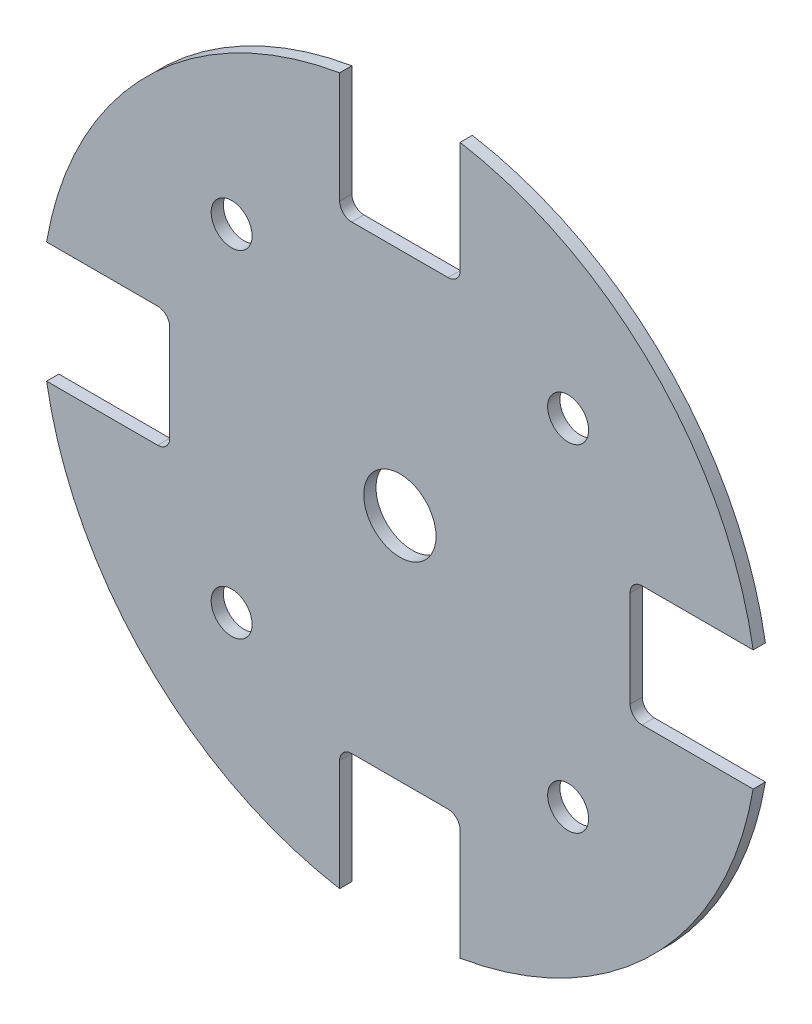
from build123d import *

# Parameters (mm, degrees)
SKETCH1_R           = 1.7
SKETCH1_R_2         = 3
BOSS_EXTRUDE1_DEPTH = 1.016


with BuildPart() as part:
    # Sketch1 → Boss-Extrude1 (new body)
    with BuildSketch(Plane.XY):
        with BuildLine():
            Line((-29.326822194, 5), (-20.106608804, 5))
            ThreePointArc((-20.106608804, 5), (-19.399502023, 4.707106781), (-19.106608804, 4))
            Line((-19.106608804, 4), (-19.106608804, -4))
            ThreePointArc((-19.106608804, -4), (-19.399502023, -4.707106781), (-20.106608804, -5))
            Line((-20.106608804, -5), (-29.326822194, -5))
            ThreePointArc((-29.326822194, -5), (-21.03642674, -21.03642674), (-5, -29.326822194))
            Line((-5, -29.326822194), (-5, -20.106608804))
            ThreePointArc((-5, -20.106608804), (-4.707106781, -19.399502023), (-4, -19.106608804))
            Line((-4, -19.106608804), (4, -19.106608804))
            ThreePointArc((4, -19.106608804), (4.707106781, -19.399502023), (5, -20.106608804))
            Line((5, -20.106608804), (5, -29.326822194))
            ThreePointArc((5, -29.326822194), (21.03642674, -21.03642674), (29.326822194, -5))
            Line((29.326822194, -5), (20.106608804, -5))
            ThreePointArc((20.106608804, -5), (19.399502023, -4.707106781), (19.106608804, -4))
            Line((19.106608804, -4), (19.106608804, 4))
            ThreePointArc((19.106608804, 4), (19.399502023, 4.707106781), (20.106608804, 5))
            Line((20.106608804, 5), (29.326822194, 5))
            ThreePointArc((29.326822194, 5), (21.03642674, 21.03642674), (5, 29.326822194))
            Line((5, 29.326822194), (5, 20.106608804))
            ThreePointArc((5, 20.106608804), (4.707106781, 19.399502023), (4, 19.106608804))
            Line((4, 19.106608804), (-4, 19.106608804))
            ThreePointArc((-4, 19.106608804), (-4.707106781, 19.399502023), (-5, 20.106608804))
            Line((-5, 20.106608804), (-5, 29.326822194))
            ThreePointArc((-5, 29.326822194), (-21.03642674, 21.03642674), (-29.326822194, 5))
        make_face()
        with Locations((13.965358928, 13.965358928)):
            Circle(SKETCH1_R, mode=Mode.SUBTRACT)
        with Locations((13.965358928, -13.965358928)):
            Circle(SKETCH1_R, mode=Mode.SUBTRACT)
        with Locations((-13.965358928, -13.965358928)):
            Circle(SKETCH1_R, mode=Mode.SUBTRACT)
        with Locations((-13.965358928, 13.965358928)):
            Circle(SKETCH1_R, mode=Mode.SUBTRACT)
        Circle(SKETCH1_R_2, mode=Mode.SUBTRACT)
    extrude(amount=BOSS_EXTRUDE1_DEPTH)


solid = part.part
